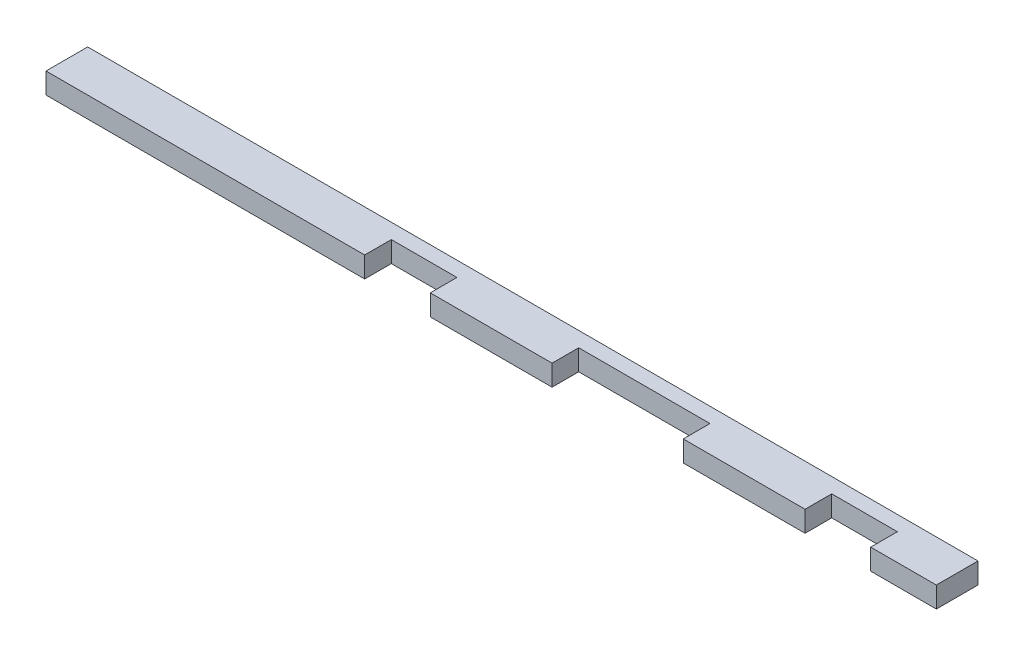
from build123d import *

# Parameters (mm, degrees)
BOSS_EXTRUDE1_DEPTH = 1.5875


with BuildPart() as part:
    # Sketch1 → Boss-Extrude1 (new body)
    with BuildSketch(Plane(origin=(0, 0, 0), x_dir=(1, 0, 0), z_dir=(0, 1, 0))):
        Polygon((0, 0), (24.27563042, 0), (24.27563042, 2.032), (29.27563042, 2.032), (29.27563042, 0), (38.55125958, 0), (38.55125958, 2.032), (48.55125958, 2.032), (48.55125958, 0), (57.82689, 0), (57.82689, 2.032), (62.82689, 2.032), (62.82689, 0), (67.82689, 0), (67.82689, 3.175), (0, 3.175), align=None)
    extrude(amount=BOSS_EXTRUDE1_DEPTH)


solid = part.part
